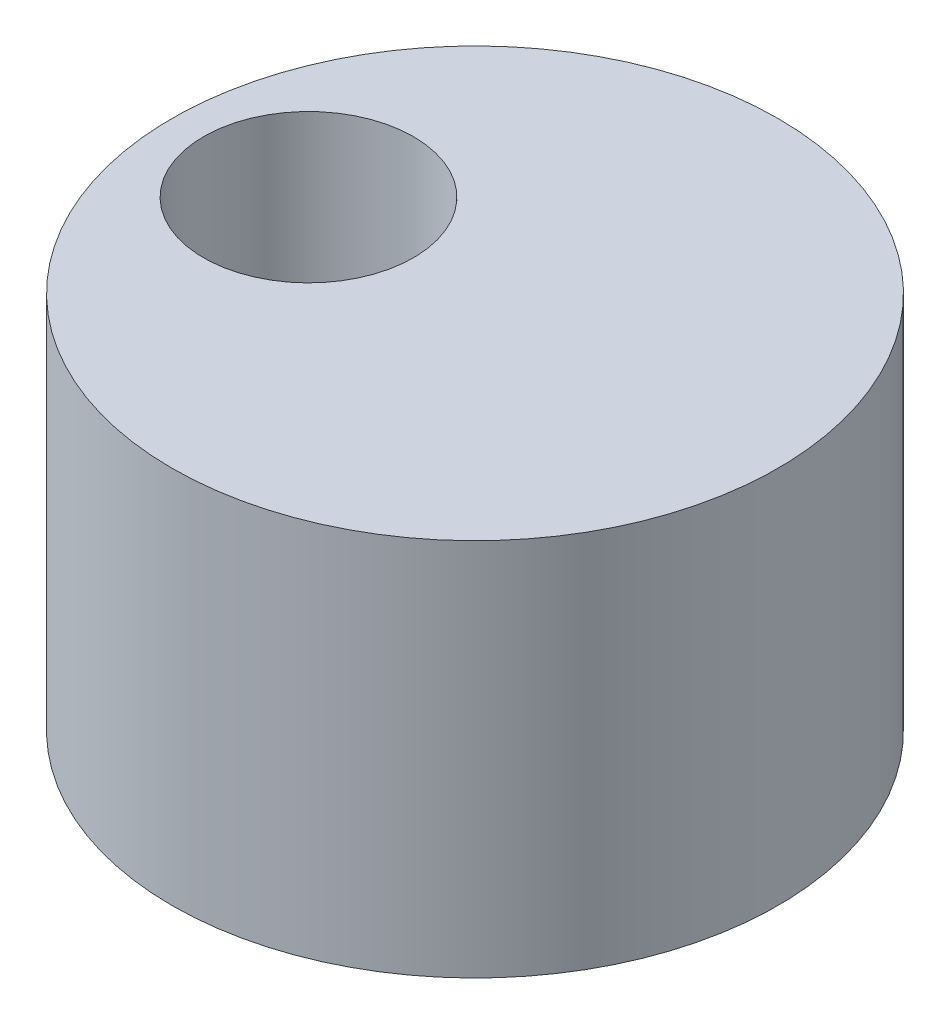
from build123d import *

# Parameters (mm, degrees)
SKETCH1_R           = 6.35
BOSS_EXTRUDE1_DEPTH = 7.9375
SKETCH2_R           = 2.2
CUT_EXTRUDE1_DEPTH  = 12.985362166
SKETCH3_R           = 1
CUT_EXTRUDE2_DEPTH  = 3.4


with BuildPart() as part:
    # Sketch1 → Boss-Extrude1 (new body)
    with BuildSketch(Plane(origin=(0, 0, 0), x_dir=(1, 0, 0), z_dir=(0, 1, 0))):
        with Locations(Location((0, 0, 0), (0, 0, 270))):
            Circle(SKETCH1_R)
    extrude(amount=BOSS_EXTRUDE1_DEPTH)

    # Sketch2 → Cut-Extrude1 (cut, through all)
    with BuildSketch(Plane.XZ):
        with Locations(Location((-3.49, 0, 0), (0, 0, 270))):
            Circle(SKETCH2_R)
    extrude(amount=-CUT_EXTRUDE1_DEPTH, mode=Mode.SUBTRACT)

    # Sketch3 → Cut-Extrude2 (cut)
    with BuildSketch(Plane.XZ):
        with Locations(Location((-3.49, -3.8, 0), (0, 0, 270))):
            Circle(SKETCH3_R)
        with Locations(Location((-3.49, 3.8, 0), (0, 0, 270))):
            Circle(SKETCH3_R)
    extrude(amount=-CUT_EXTRUDE2_DEPTH, mode=Mode.SUBTRACT)


solid = part.part
